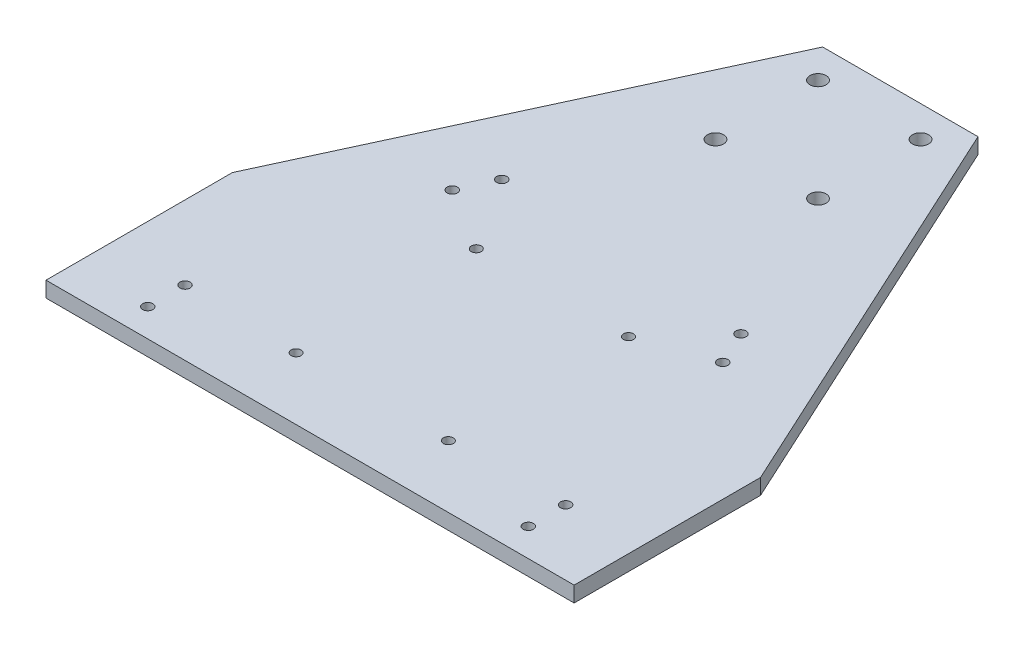
from build123d import *

# Parameters (mm, degrees)
EXTRUDE_1_DEPTH             = 5
SKETCH_2_R                  = 1.6
CUT_EXTRUDE_1_DEPTH         = 5
PATTERN_LINEAR_1_COUNT      = 2
PATTERN_LINEAR_1_PITCH      = 58
PATTERN_LINEAR_1_COUNT_DIR2 = 2
PATTERN_LINEAR_1_PITCH_DIR2 = 49
SKETCH_3_R                  = 2.6
CUT_EXTRUDE_2_DEPTH         = 10
PATTERN_LINEAR_2_COUNT      = 2
PATTERN_LINEAR_2_PITCH      = 33
PATTERN_LINEAR_2_COUNT_DIR2 = 2
PATTERN_LINEAR_2_PITCH_DIR2 = 33
SKETCH_4_R                  = 1.65
CUT_EXTRUDE_4_DEPTH         = 10


with BuildPart() as part:
    # Эскиз1 → Бобышка-Вытянуть1 (new body)
    with BuildSketch(Plane(origin=(0, 0, 0), x_dir=(1, 0, 0), z_dir=(0, 1, 0))):
        Polygon((0, 0), (170, 0), (170, 60), (110, 190), (60, 190), (0, 60), align=None)
    extrude(amount=EXTRUDE_1_DEPTH)

    # Эскиз2 → Вырез-Вытянуть1 (cut)
    with BuildSketch(Plane(origin=(0, 5, 0), x_dir=(1, 0, 0), z_dir=(0, 1, 0))):
        with Locations(Location((60.5, 20, 0), (0, 0, 270))):
            Circle(SKETCH_2_R)
    cut_extrude_1 = extrude(amount=-CUT_EXTRUDE_1_DEPTH, mode=Mode.SUBTRACT)

    # Линейный массив1: Cut-Extrude 1 2 × 2
    with Locations(*[(j * PATTERN_LINEAR_1_PITCH_DIR2, 0, -i * PATTERN_LINEAR_1_PITCH) for i in range(PATTERN_LINEAR_1_COUNT) for j in range(PATTERN_LINEAR_1_COUNT_DIR2) if (i, j) != (0, 0)]):
        add(cut_extrude_1, mode=Mode.SUBTRACT)

    # Эскиз3 → Вырез-Вытянуть2 (cut)
    with BuildSketch(Plane(origin=(0, 5, 0), x_dir=(1, 0, 0), z_dir=(0, 1, 0))):
        with Locations(Location((101.5, 180, 0), (0, 0, 270))):
            Circle(SKETCH_3_R)
    cut_extrude_2 = extrude(amount=-CUT_EXTRUDE_2_DEPTH, mode=Mode.SUBTRACT)

    # Линейный массив2: Cut-Extrude 2 2 × 2
    with Locations(*[(-i * PATTERN_LINEAR_2_PITCH, 0, j * PATTERN_LINEAR_2_PITCH_DIR2) for i in range(PATTERN_LINEAR_2_COUNT) for j in range(PATTERN_LINEAR_2_COUNT_DIR2) if (i, j) != (0, 0)]):
        add(cut_extrude_2, mode=Mode.SUBTRACT)

    # Эскиз4 → Вырез-Вытянуть4 (cut)
    with BuildSketch(Plane(origin=(0, 5, 0), x_dir=(1, 0, 0), z_dir=(0, 1, 0))):
        with Locations(Location((23.75, 8.999743724, 0), (0, 0, 270))):
            Circle(SKETCH_4_R)
        with Locations(Location((23.75, 20.999743724, 0), (0, 0, 270))):
            Circle(SKETCH_4_R)
        with Locations(Location((146.25, 20.999743724, 0), (0, 0, 270))):
            Circle(SKETCH_4_R)
        with Locations(Location((146.25, 8.999743724, 0), (0, 0, 270))):
            Circle(SKETCH_4_R)
        with Locations(Location((45.274277733, 101.419560045, 0), (0, 0, 270))):
            Circle(SKETCH_4_R)
        with Locations(Location((40.245579603, 90.524047431, 0), (0, 0, 270))):
            Circle(SKETCH_4_R)
        with Locations(Location((126.821084869, 96.879607741, 0), (0, 0, 270))):
            Circle(SKETCH_4_R)
        with Locations(Location((131.849782999, 85.984095127, 0), (0, 0, 270))):
            Circle(SKETCH_4_R)
    extrude(amount=-CUT_EXTRUDE_4_DEPTH, mode=Mode.SUBTRACT)


solid = part.part
